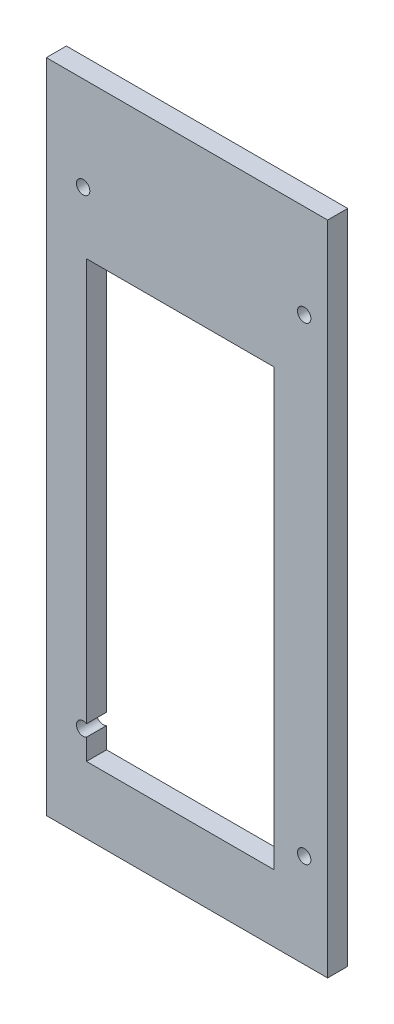
from build123d import *

# Parameters (mm, degrees)
SKETCH1_W           = 30
SKETCH1_H           = 65
BOSS_EXTRUDE1_DEPTH = 3
SKETCH3_R           = 1
CUT_EXTRUDE1_DEPTH  = 3
SKETCH4_W           = 2
SKETCH4_H           = 65
BOSS_EXTRUDE2_DEPTH = 3


with BuildPart() as part:
    # Sketch1 → Boss-Extrude1 (new body)
    with BuildSketch(Plane.XY):
        Polygon((0, 0), (0, -114.006141835), (0, -92.003070917), (0, -106.003070917), (6, -106.003070917), (36, -106.003070917), (42, -106.003070917), (42, -92.003070917), (42, -114.006141835), (42, 0), (42, -22.003070917), (42, -8.003070917), (36, -8.003070917), (6, -8.003070917), (0, -8.003070917), (0, -22.003070917), align=None)
        with Locations((21, -63.503070917)):
            Rectangle(SKETCH1_W, SKETCH1_H, mode=Mode.SUBTRACT)
    extrude(amount=BOSS_EXTRUDE1_DEPTH)

    # Sketch3 → Cut-Extrude1 (cut)
    with BuildSketch(Plane(origin=(0, 0, 0), x_dir=(-1, 0, 0), z_dir=(0, 0, -1))):
        with Locations((-38.5, -22.003070917)):
            Circle(SKETCH3_R)
        with Locations((-5.5, -22.003070917)):
            Circle(SKETCH3_R)
        with Locations((-5.5, -92.003070917)):
            Circle(SKETCH3_R)
        with Locations((-38.5, -92.003070917)):
            Circle(SKETCH3_R)
    extrude(amount=-CUT_EXTRUDE1_DEPTH, mode=Mode.SUBTRACT)

    # Sketch4 → Boss-Extrude2 (add)
    with BuildSketch(Plane.XY.offset(3)):
        with Locations((35, -63.503070917)):
            Rectangle(SKETCH4_W, SKETCH4_H)
    extrude(amount=-BOSS_EXTRUDE2_DEPTH)


solid = part.part
